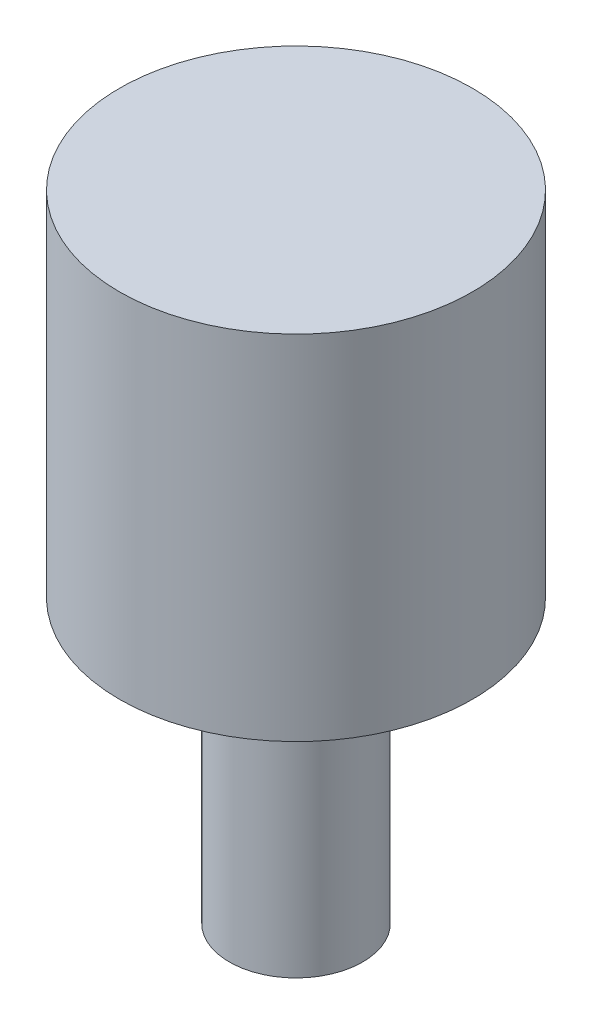
from build123d import *

# Parameters (mm, degrees)
SKETCH2_R           = 3.96875
BOSS_EXTRUDE4_DEPTH = 7.9375
SKETCH4_R           = 1.5
BOSS_EXTRUDE5_DEPTH = 6.35


with BuildPart() as part:
    # Sketch2 → Boss-Extrude4 (new body)
    with BuildSketch(Plane(origin=(0, 0, 0), x_dir=(1, 0, 0), z_dir=(0, 1, 0))):
        with Locations(Location((0, 0, 0), (0, 0, 270))):
            Circle(SKETCH2_R)
    extrude(amount=BOSS_EXTRUDE4_DEPTH)

    # Sketch4 → Boss-Extrude5 (add)
    with BuildSketch(Plane.XZ):
        with Locations(Location((0, 0, 0), (0, 0, 270))):
            Circle(SKETCH4_R)
    extrude(amount=BOSS_EXTRUDE5_DEPTH)


solid = part.part
